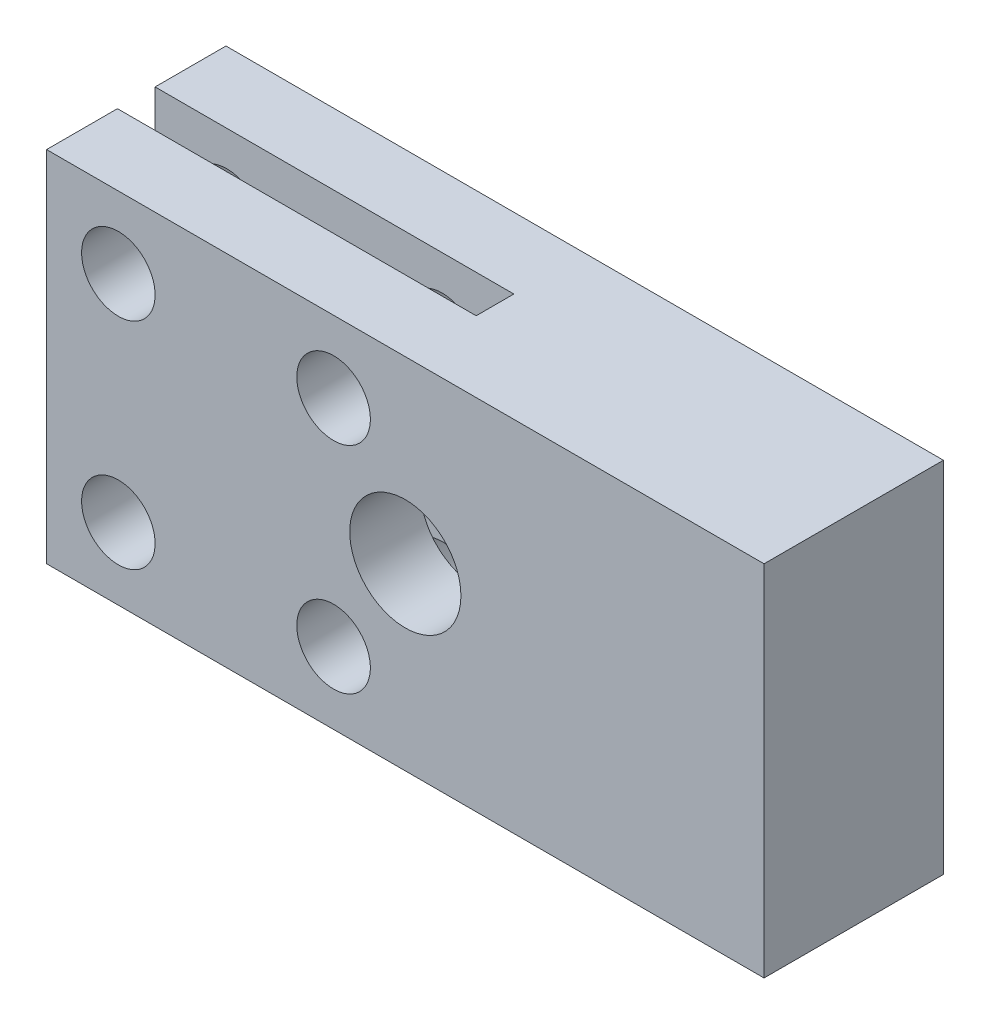
from build123d import *

# Parameters (mm, degrees)
ESQUISSE1_W             = 40
ESQUISSE1_H             = 20
BOSS_EXTRU_1_DEPTH      = 10
ESQUISSE2_R             = 3.1
ENL_V_MAT_EXTRU_1_DEPTH = 10
ESQUISSE3_W             = 40
ESQUISSE3_H             = 2.1
ENL_V_MAT_EXTRU_2_DEPTH = 31
ESQUISSE4_R             = 2.05
ENL_V_MAT_EXTRU_3_DEPTH = 25.494897428


with BuildPart() as part:
    # Esquisse1 → Boss.-Extru.1 (new body)
    with BuildSketch(Plane.XY):
        Rectangle(ESQUISSE1_W, ESQUISSE1_H)
    extrude(amount=BOSS_EXTRU_1_DEPTH)

    # Esquisse2 → Enlèv. mat.-Extru.1 (cut)
    with BuildSketch(Plane.XY.offset(10)):
        Circle(ESQUISSE2_R)
    extrude(amount=-ENL_V_MAT_EXTRU_1_DEPTH, mode=Mode.SUBTRACT)

    # Esquisse3 → Enlèv. mat.-Extru.2 (cut, through all)
    with BuildSketch(Plane(origin=(0, -10, 0), x_dir=(-1, 0, 0), z_dir=(0, -1, 0))):
        with Locations((20, -5)):
            Rectangle(ESQUISSE3_W, ESQUISSE3_H)
    extrude(amount=-ENL_V_MAT_EXTRU_2_DEPTH, mode=Mode.SUBTRACT)

    # Esquisse4 → Enlèv. mat.-Extru.3 (cut, through all)
    with BuildSketch(Plane(origin=(0, 0, 0), x_dir=(-1, 0, 0), z_dir=(0, 0, -1))):
        with Locations((16, 6)):
            Circle(ESQUISSE4_R)
        with Locations((4, 6)):
            Circle(ESQUISSE4_R)
        with Locations((4, -6)):
            Circle(ESQUISSE4_R)
        with Locations((16, -6)):
            Circle(ESQUISSE4_R)
    extrude(amount=-ENL_V_MAT_EXTRU_3_DEPTH, mode=Mode.SUBTRACT)


solid = part.part
